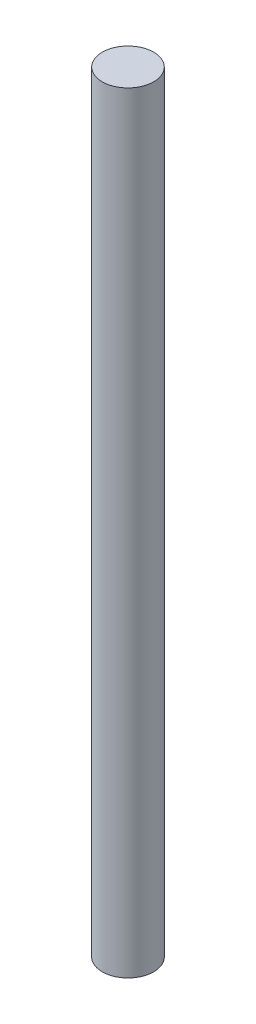
from build123d import *

# Parameters (mm, degrees)
SKETCH2_R           = 5
BOSS_EXTRUDE1_DEPTH = 150


with BuildPart() as part:
    # Sketch2 → Boss-Extrude1 (new body)
    with BuildSketch(Plane(origin=(0, 0, 0), x_dir=(1, 0, 0), z_dir=(0, 1, 0))):
        with Locations(Location((0, 0, 0), (0, 0, 270))):
            Circle(SKETCH2_R)
    extrude(amount=BOSS_EXTRUDE1_DEPTH)


solid = part.part
